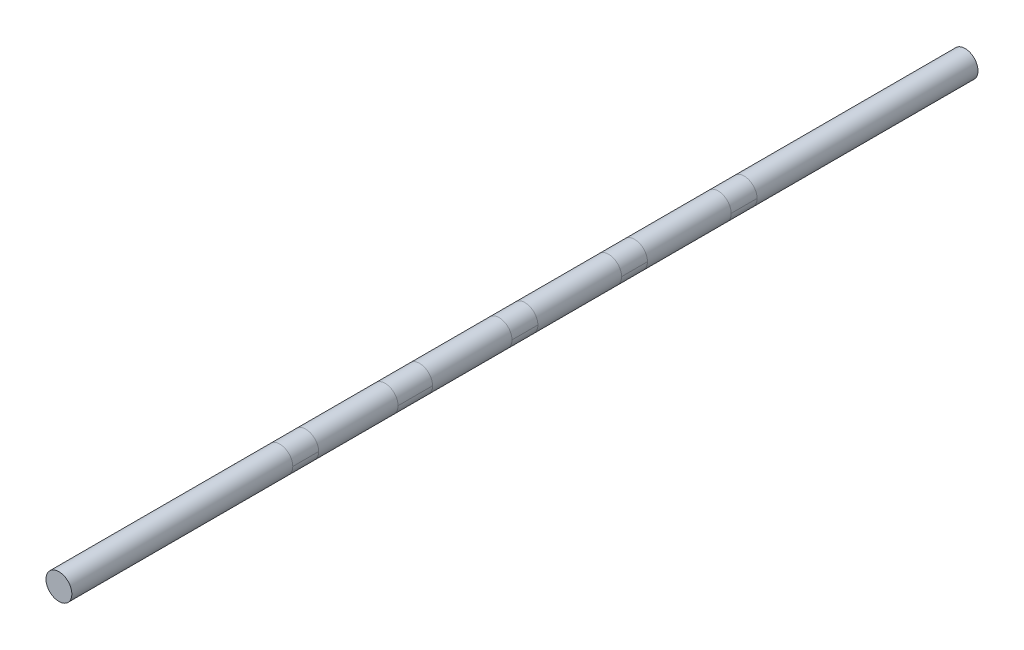
from build123d import *

# Parameters (mm, degrees)
SKETCH1_R           = 14.986
BOSS_EXTRUDE1_DEPTH = 1050


with BuildPart() as part:
    # Sketch1 → Boss-Extrude1 (new body)
    with BuildSketch(Plane.XY):
        Circle(SKETCH1_R)
    extrude(amount=BOSS_EXTRUDE1_DEPTH)


solid = part.part
